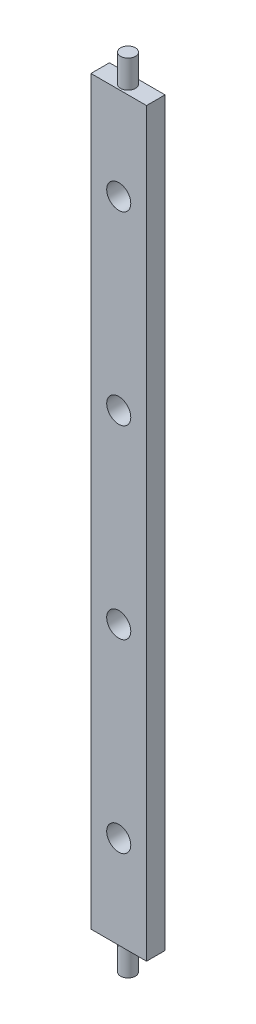
from build123d import *

# Parameters (mm, degrees)
SKETCH1_W             = 6
SKETCH1_H             = 80
ROD_BAR_DEPTH         = 2
LINK_HOLES_DEPTH      = 41.162171256
LINK_HOLES_DEPTH_BACK = 41.162171256
SKETCH2_R             = 1.3
SKETCH3_R             = 0.8
SMA_SPRING_PEG_DEPTH  = 3
BIAS_SPRING_PEG_START = 3
SKETCH4_R             = 0.8
BIAS_SPRING_PEG_DEPTH = 3


with BuildPart() as part:
    # Sketch1 → Rod_Bar (new body)
    with BuildSketch(Plane.XY):
        Rectangle(SKETCH1_W, SKETCH1_H)
    extrude(amount=ROD_BAR_DEPTH)

    # Sketch2 → Link_Holes (cut, two sides: drawn at the far end of the back side and taken through both)
    with BuildSketch(Plane.XY.offset(-LINK_HOLES_DEPTH_BACK)):
        with Locations((0, -30)):
            Circle(SKETCH2_R)
        with Locations((0, -10)):
            Circle(SKETCH2_R)
        with Locations((0, 10)):
            Circle(SKETCH2_R)
        with Locations((0, 30)):
            Circle(SKETCH2_R)
    extrude(amount=LINK_HOLES_DEPTH + LINK_HOLES_DEPTH_BACK, mode=Mode.SUBTRACT)

    # Sketch3 → SMA_Spring_Peg (add)
    with BuildSketch(Plane(origin=(0, 40, 0), x_dir=(1, 0, 0), z_dir=(0, 1, 0))):
        with Locations(Location((0, -1, 0), (0, 0, 270))):
            Circle(SKETCH3_R)
    extrude(amount=SMA_SPRING_PEG_DEPTH)

    # Sketch4 → Bias_Spring_Peg (add)
    with BuildSketch(Plane.XZ.offset(40).offset(BIAS_SPRING_PEG_START)):
        with Locations(Location((0, 1, 0), (0, 0, 90))):
            Circle(SKETCH4_R)
    extrude(amount=-BIAS_SPRING_PEG_DEPTH)


solid = part.part
